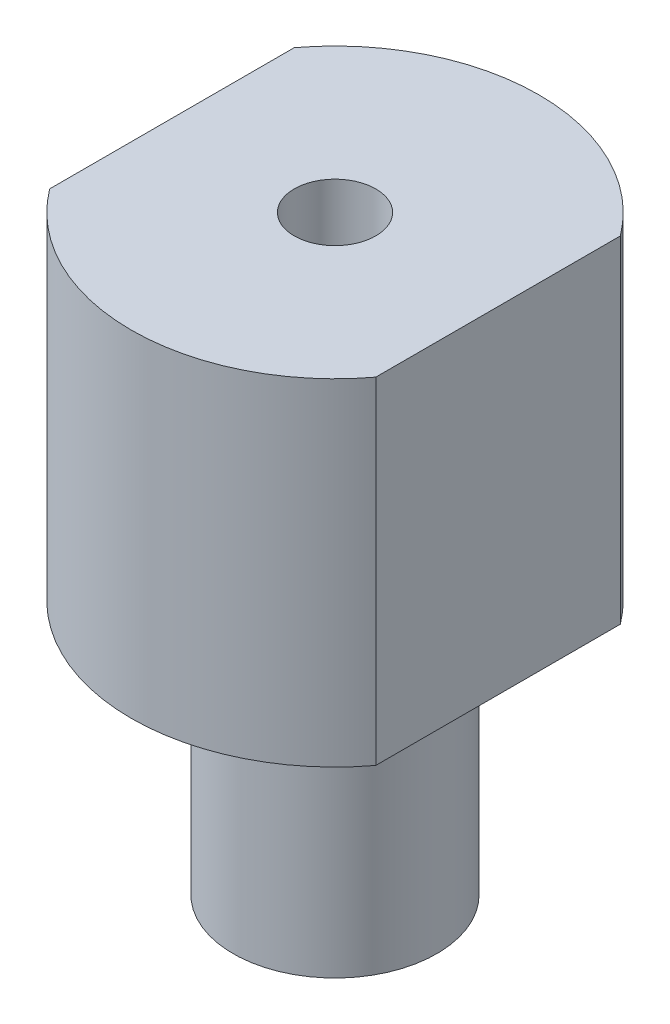
from build123d import *

# Parameters (mm, degrees)
EXTRUDE_1_DEPTH     = 33
SKETCH_2_R          = 10
EXTRUDE_2_DEPTH     = 25
SKETCH_3_R          = 4
CUT_EXTRUDE_1_DEPTH = 8
SKETCH_4_R          = 3.46188381
CUT_EXTRUDE_2_DEPTH = 25


with BuildPart() as part:
    # 草图1 → 凸台-拉伸1 (new body)
    with BuildSketch(Plane(origin=(0, 0, 0), x_dir=(1, 0, 0), z_dir=(0, 1, 0))):
        with BuildLine():
            Line((-16, 12), (-16, -12))
            ThreePointArc((-16, -12), (0, -20), (16, -12))
            Line((16, -12), (16, 12))
            ThreePointArc((16, 12), (0, 20), (-16, 12))
        make_face()
    extrude(amount=EXTRUDE_1_DEPTH)

    # 草图2 → 凸台-拉伸2 (add)
    with BuildSketch(Plane.XZ):
        with Locations(Location((0, 0, 0), (0, 0, 270))):
            Circle(SKETCH_2_R)
    extrude(amount=EXTRUDE_2_DEPTH)

    # 草图3 → 切除-拉伸1 (cut)
    with BuildSketch(Plane(origin=(0, 33, 0), x_dir=(1, 0, 0), z_dir=(0, 1, 0))):
        with Locations(Location((0, 0, 0), (0, 0, 270))):
            Circle(SKETCH_3_R)
    extrude(amount=-CUT_EXTRUDE_1_DEPTH, mode=Mode.SUBTRACT)

    # 草图4 → 切除-拉伸2 (cut)
    with BuildSketch(Plane.XZ.offset(25)):
        with Locations(Location((0, 0, 0), (0, 0, 270))):
            Circle(SKETCH_4_R)
    extrude(amount=-CUT_EXTRUDE_2_DEPTH, mode=Mode.SUBTRACT)


solid = part.part
